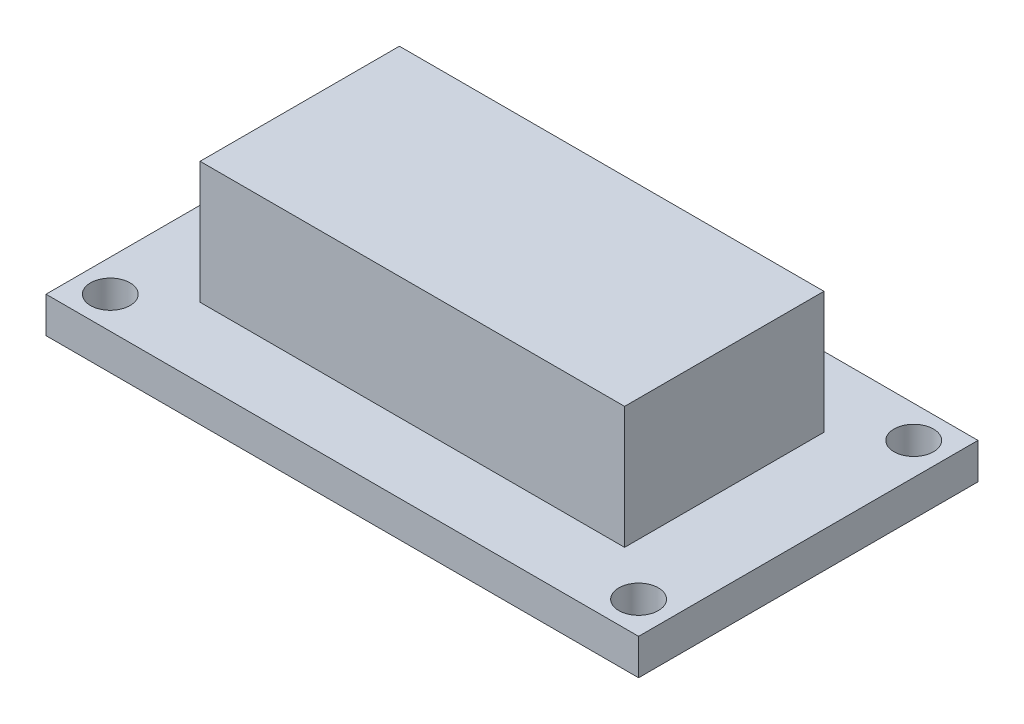
from build123d import *

# Parameters (mm, degrees)
SKETCH1_W           = 41.91
SKETCH1_H           = 24.003
SKETCH1_R           = 1.397
BOSS_EXTRUDE1_DEPTH = 2.54
SKETCH2_W           = 30.0228
SKETCH2_H           = 14.097
BOSS_EXTRUDE2_DEPTH = 8.636


with BuildPart() as part:
    # Sketch1 → Boss-Extrude1 (new body)
    with BuildSketch(Plane(origin=(0, 0, 0), x_dir=(1, 0, 0), z_dir=(0, 1, 0))):
        Rectangle(SKETCH1_W, SKETCH1_H)
        with Locations(Location((-18.6817, 9.7282, 0), (0, 0, 270))):
            Circle(SKETCH1_R, mode=Mode.SUBTRACT)
        with Locations(Location((-18.6817, -9.7282, 0), (0, 0, 90))):
            Circle(SKETCH1_R, mode=Mode.SUBTRACT)
        with Locations(Location((18.6817, -9.7282, 0), (0, 0, 270))):
            Circle(SKETCH1_R, mode=Mode.SUBTRACT)
        with Locations(Location((18.6817, 9.7282, 0), (0, 0, 90))):
            Circle(SKETCH1_R, mode=Mode.SUBTRACT)
    extrude(amount=BOSS_EXTRUDE1_DEPTH)

    # Sketch2 → Boss-Extrude2 (add)
    with BuildSketch(Plane(origin=(0, 2.54, 0), x_dir=(1, 0, 0), z_dir=(0, 1, 0))):
        Rectangle(SKETCH2_W, SKETCH2_H)
    extrude(amount=BOSS_EXTRUDE2_DEPTH)


solid = part.part
